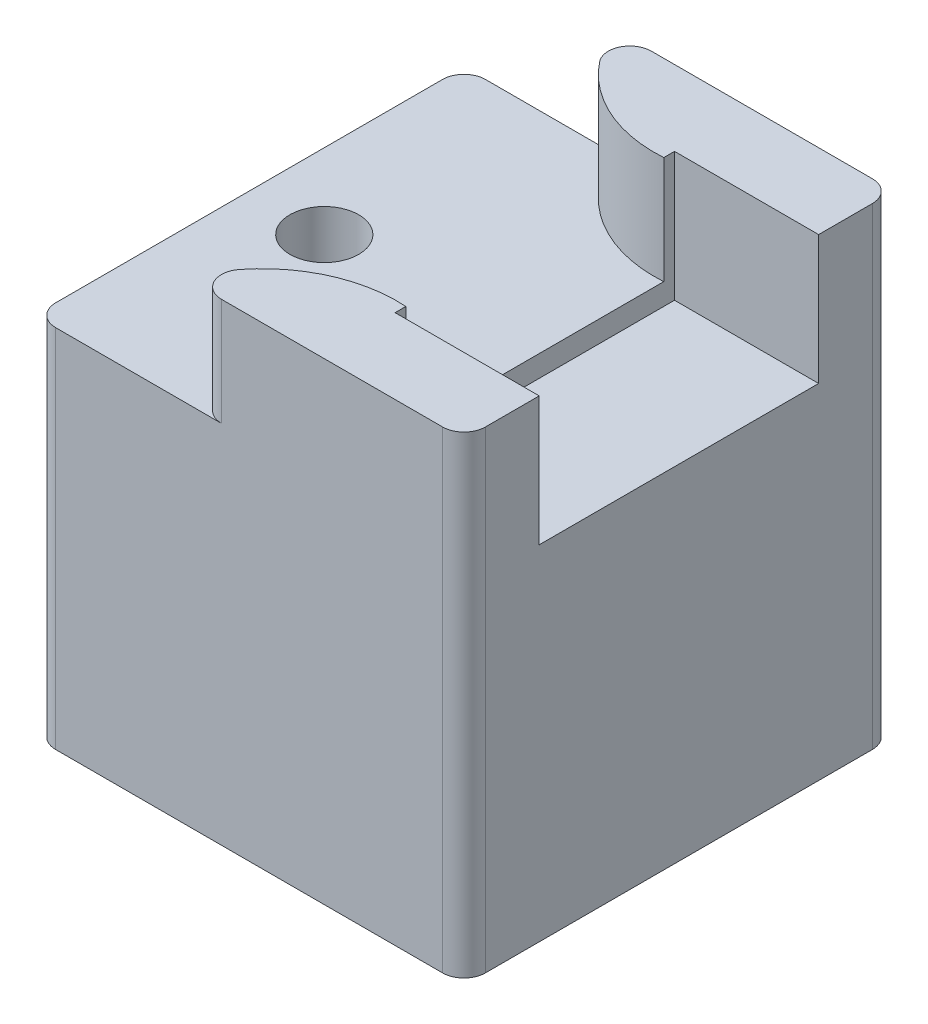
from build123d import *

# Parameters (mm, degrees)
CROQUIS2_W              = 20
CROQUIS2_H              = 20
SALIENTE_EXTRUIR1_DEPTH = 8
CROQUIS3_W              = 6.705751287
CROQUIS3_H              = 13
CORTAR_EXTRUIR1_DEPTH   = 6
CORTAR_EXTRUIR2_DEPTH   = 5
CROQUIS6_R              = 1.6
CORTAR_EXTRUIR3_DEPTH   = 3
REDONDEO1_R             = 1
CROQUIS7_R              = 1.6
SALIENTE_EXTRUIR2_DEPTH = 14


with BuildPart() as part:
    # Croquis2 → Saliente-Extruir1 (new body)
    with BuildSketch(Plane(origin=(0, 0, 0), x_dir=(1, 0, 0), z_dir=(0, 1, 0))):
        with Locations((-0.843373494, -1.526104418)):
            Rectangle(CROQUIS2_W, CROQUIS2_H)
    extrude(amount=SALIENTE_EXTRUIR1_DEPTH)

    # Croquis3 → Cortar-Extruir1 (cut)
    with BuildSketch(Plane(origin=(0, 8, 0), x_dir=(1, 0, 0), z_dir=(0, 1, 0))):
        with Locations((5.803750863, -1.526104418)):
            Rectangle(CROQUIS3_W, CROQUIS3_H)
    extrude(amount=-CORTAR_EXTRUIR1_DEPTH, mode=Mode.SUBTRACT)

    # Croquis5 → Cortar-Extruir2 (cut)
    with BuildSketch(Plane(origin=(0, 8, 0), x_dir=(1, 0, 0), z_dir=(0, 1, 0))):
        with BuildLine():
            Line((2.450875219, -7.526104418), (2.450875219, 4.473895582))
            ThreePointArc((2.450875219, 4.473895582), (2.020425803, 4.459111389), (1.589976387, 4.473895582))
            ThreePointArc((1.589976387, 4.473895582), (-1.703861847, 5.684131739), (-3.832537389, 8.473895582))
            Line((-3.832537389, 8.473895582), (-10.843373494, 8.473895582))
            Line((-10.843373494, 8.473895582), (-10.843373494, -11.526104418))
            Line((-10.843373494, -11.526104418), (-3.832537389, -11.526104418))
            ThreePointArc((-3.832537389, -11.526104418), (-1.703861847, -8.736340574), (1.589976387, -7.526104418))
            ThreePointArc((1.589976387, -7.526104418), (2.020425803, -7.511320225), (2.450875219, -7.526104418))
        make_face()
    extrude(amount=-CORTAR_EXTRUIR2_DEPTH, mode=Mode.SUBTRACT)

    # Croquis6 → Cortar-Extruir3 (cut)
    with BuildSketch(Plane(origin=(0, 3, 0), x_dir=(1, 0, 0), z_dir=(0, 1, 0))):
        with Locations(Location((-7.343373494, -1.526104418, 0), (0, 0, 270))):
            Circle(CROQUIS6_R)
    extrude(amount=-CORTAR_EXTRUIR3_DEPTH, mode=Mode.SUBTRACT)

    # Redondeo1
    redondeo1_edges = [part.edges().sort_by_distance(p)[0] for p in [
        (-10.843373494, 1.5, -8.473895582),
        (-10.843373494, 1.5, 11.526104418),
        (-3.832537389, 5.5, 11.526104418),
        (-3.832537389, 5.5, -8.473895582),
        (9.156626506, 4, -8.473895582),
        (9.156626506, 4, 11.526104418),
    ]]
    fillet(redondeo1_edges, radius=REDONDEO1_R)

    # Croquis7 → Saliente-Extruir2 (add)
    with BuildSketch(Plane.XZ):
        with BuildLine():
            Line((-9.843373494, -8.473895582), (8.156626506, -8.473895582))
            ThreePointArc((8.156626506, -8.473895582), (8.863733287, -8.181002364), (9.156626506, -7.473895582))
            Line((9.156626506, -7.473895582), (9.156626506, 10.526104418))
            ThreePointArc((9.156626506, 10.526104418), (8.863733287, 11.233211199), (8.156626506, 11.526104418))
            Line((8.156626506, 11.526104418), (-9.843373494, 11.526104418))
            ThreePointArc((-9.843373494, 11.526104418), (-10.550480275, 11.233211199), (-10.843373494, 10.526104418))
            Line((-10.843373494, 10.526104418), (-10.843373494, -7.473895582))
            ThreePointArc((-10.843373494, -7.473895582), (-10.550480275, -8.181002364), (-9.843373494, -8.473895582))
        make_face()
        with Locations(Location((-7.343373494, 1.526104418, 0), (0, 0, 90))):
            Circle(CROQUIS7_R, mode=Mode.SUBTRACT)
    extrude(amount=SALIENTE_EXTRUIR2_DEPTH)


solid = part.part
